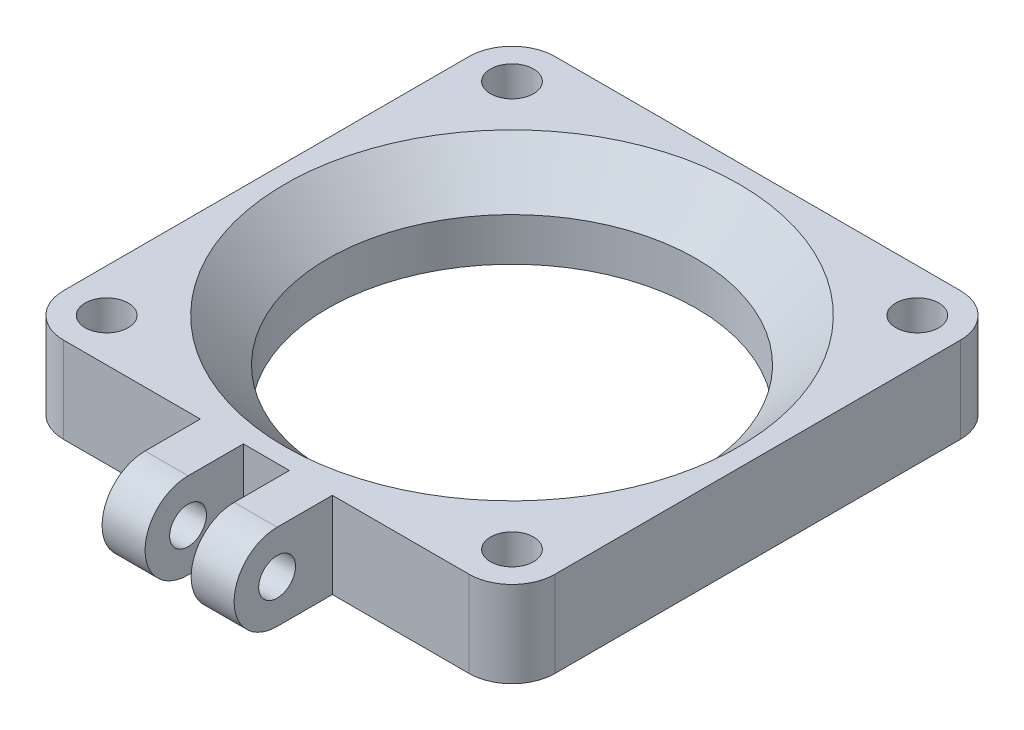
from build123d import *

# Parameters (mm, degrees)
BOSS_EXTRUDE1_DEPTH = 7
CUT_EXTRUDE2_REACH  = 31.138
SKETCH3_R           = 1.75
SKETCH7_W           = 3.5
SKETCH7_H           = 28
BOSS_EXTRUDE2_DEPTH = 7
CUT_EXTRUDE3_DEPTH  = 39.430334698
SKETCH9_R           = 1.5
CUT_EXTRUDE4_DEPTH  = 39.430334698
SKETCH13_R          = 15
CUT_EXTRUDE5_DEPTH  = 36.114099732


with BuildPart() as part:
    # Sketch1 → Boss-Extrude1 (new body)
    with BuildSketch(Plane(origin=(0, 0, 0), x_dir=(1, 0, 0), z_dir=(0, 1, 0))):
        with BuildLine():
            Line((-16.5, 20), (16.5, 20))
            ThreePointArc((16.5, 20), (18.974873734, 18.974873734), (20, 16.5))
            Line((20, 16.5), (20, -16.5))
            ThreePointArc((20, -16.5), (18.974873734, -18.974873734), (16.5, -20))
            Line((16.5, -20), (-16.5, -20))
            ThreePointArc((-16.5, -20), (-18.974873734, -18.974873734), (-20, -16.5))
            Line((-20, -16.5), (-20, 16.5))
            ThreePointArc((-20, 16.5), (-18.974873734, 18.974873734), (-16.5, 20))
        make_face()
    extrude(amount=BOSS_EXTRUDE1_DEPTH)

    # Sketch3 → Cut-Extrude2 (cut, up to next)
    with BuildSketch(Plane(origin=(0, 7, 0), x_dir=(1, 0, 0), z_dir=(0, 1, 0)), mode=Mode.PRIVATE) as cut_extrude2_sk1:
        with Locations(Location((-16.5, 16.5, 0), (0, 0, 270))):
            Circle(SKETCH3_R)
    cut_extrude2_tool1 = extrude(cut_extrude2_sk1.sketch, amount=-CUT_EXTRUDE2_REACH, mode=Mode.PRIVATE) & part.part
    # Sketch3 → Cut-Extrude2 (cut, up to next)
    with BuildSketch(Plane(origin=(0, 7, 0), x_dir=(1, 0, 0), z_dir=(0, 1, 0)), mode=Mode.PRIVATE) as cut_extrude2_sk2:
        with Locations(Location((16.5, 16.5, 0), (0, 0, 270))):
            Circle(SKETCH3_R)
    cut_extrude2_tool2 = extrude(cut_extrude2_sk2.sketch, amount=-CUT_EXTRUDE2_REACH, mode=Mode.PRIVATE) & part.part
    # Sketch3 → Cut-Extrude2 (cut, up to next)
    with BuildSketch(Plane(origin=(0, 7, 0), x_dir=(1, 0, 0), z_dir=(0, 1, 0)), mode=Mode.PRIVATE) as cut_extrude2_sk3:
        with Locations(Location((16.5, -16.5, 0), (0, 0, 270))):
            Circle(SKETCH3_R)
    cut_extrude2_tool3 = extrude(cut_extrude2_sk3.sketch, amount=-CUT_EXTRUDE2_REACH, mode=Mode.PRIVATE) & part.part
    # Sketch3 → Cut-Extrude2 (cut, up to next)
    with BuildSketch(Plane(origin=(0, 7, 0), x_dir=(1, 0, 0), z_dir=(0, 1, 0)), mode=Mode.PRIVATE) as cut_extrude2_sk4:
        with Locations(Location((-16.5, -16.5, 0), (0, 0, 270))):
            Circle(SKETCH3_R)
    cut_extrude2_tool4 = extrude(cut_extrude2_sk4.sketch, amount=-CUT_EXTRUDE2_REACH, mode=Mode.PRIVATE) & part.part
    add(cut_extrude2_tool1.solids().sort_by_distance((-16.5, 7, -16.5))[0], mode=Mode.SUBTRACT)
    add(cut_extrude2_tool2.solids().sort_by_distance((16.5, 7, -16.5))[0], mode=Mode.SUBTRACT)
    add(cut_extrude2_tool3.solids().sort_by_distance((16.5, 7, 16.5))[0], mode=Mode.SUBTRACT)
    add(cut_extrude2_tool4.solids().sort_by_distance((-16.5, 7, 16.5))[0], mode=Mode.SUBTRACT)

    # Sketch7 → Boss-Extrude2 (add)
    with BuildSketch(Plane.XZ):
        with Locations((3.625, 14)):
            Rectangle(SKETCH7_W, SKETCH7_H)
        with Locations((-3.625, 14)):
            Rectangle(SKETCH7_W, SKETCH7_H)
    extrude(amount=-BOSS_EXTRUDE2_DEPTH)

    # Sketch8 → Cut-Extrude3 (cut, through all)
    with BuildSketch(Plane(origin=(5.375, 0, 0), x_dir=(0, 0, -1), z_dir=(1, 0, 0))):
        with BuildLine():
            ThreePointArc((-28, 3.5), (-26.974873734, 5.974873734), (-24.5, 7))
            Line((-24.5, 7), (-28, 7))
            Line((-28, 7), (-28, 3.5))
        make_face()
        with BuildLine():
            ThreePointArc((-24.5, 0), (-26.974873734, 1.025126266), (-28, 3.5))
            Line((-28, 3.5), (-28, 0))
            Line((-28, 0), (-24.5, 0))
        make_face()
    extrude(amount=-CUT_EXTRUDE3_DEPTH, mode=Mode.SUBTRACT)

    # Sketch9 → Cut-Extrude4 (cut, through all)
    with BuildSketch(Plane(origin=(5.375, 0, 0), x_dir=(0, 0, -1), z_dir=(1, 0, 0))):
        with Locations((-24.5, 3.5)):
            Circle(SKETCH9_R)
    extrude(amount=-CUT_EXTRUDE4_DEPTH, mode=Mode.SUBTRACT)

    # Sketch13 → Cut-Extrude5 (cut, through all)
    with BuildSketch(Plane.XZ):
        with Locations(Location((0, 0, 0), (0, 0, 270))):
            Circle(SKETCH13_R)
    extrude(amount=-CUT_EXTRUDE5_DEPTH, mode=Mode.SUBTRACT)

    # Sketch14 → Cut-Revolve1 (revolve, cut)
    with BuildSketch(Plane(origin=(0, 0, 0), x_dir=(0, 0, -1), z_dir=(1, 0, 0))):
        Polygon((0, 0), (0, 7), (18.5, 7), (15, 3.5), (15, 0), align=None)
    revolve(axis=Axis((0, 7, 0), (0, -1, 0)), mode=Mode.SUBTRACT)


solid = part.part
